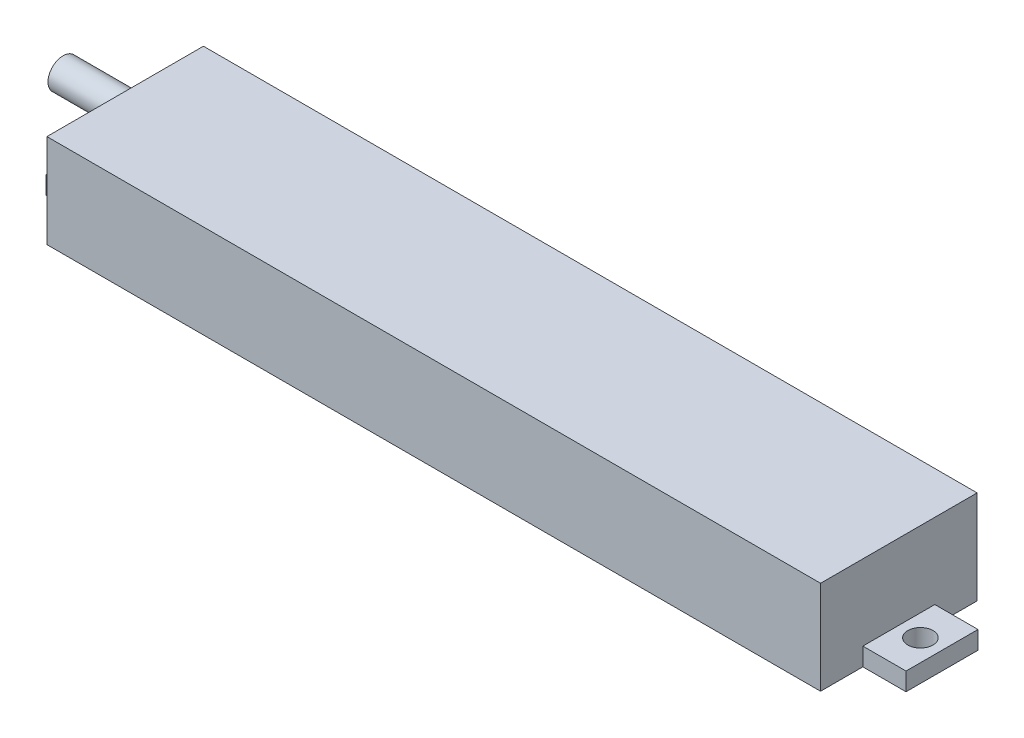
from build123d import *

# Parameters (mm, degrees)
SKETCH_1_W      = 215
SKETCH_1_H      = 43.5
EXTRUDE_1_DEPTH = 26
SKETCH_2_W      = 12
SKETCH_2_H      = 20
SKETCH_2_R      = 3.5
EXTRUDE_2_DEPTH = 5
SKETCH_3_R      = 4.2
EXTRUDE_3_DEPTH = 25


with BuildPart() as part:
    # ｽｹｯﾁ1 → ﾎﾞｽ - 押し出し1 (new body)
    with BuildSketch(Plane(origin=(0, 0, 0), x_dir=(1, 0, 0), z_dir=(0, 1, 0))):
        Rectangle(SKETCH_1_W, SKETCH_1_H)
    extrude(amount=EXTRUDE_1_DEPTH)

    # ｽｹｯﾁ2 → ﾎﾞｽ - 押し出し2 (add)
    # profile 1 of 2: a face of its own
    with BuildSketch(Plane.XZ):
        with Locations((-113.5, 0)):
            Rectangle(SKETCH_2_W, SKETCH_2_H)
        with Locations(Location((-113.5, 0, 0), (0, 0, 270))):
            Circle(SKETCH_2_R, mode=Mode.SUBTRACT)
    # profile 2 of 2: a face of its own
    with BuildSketch(Plane.XZ):
        with Locations((113.5, 0)):
            Rectangle(SKETCH_2_W, SKETCH_2_H)
        with Locations(Location((113.5, 0, 0), (0, 0, 90))):
            Circle(SKETCH_2_R, mode=Mode.SUBTRACT)
    extrude(amount=-EXTRUDE_2_DEPTH)

    # ｽｹｯﾁ3 → ﾎﾞｽ - 押し出し3 (add)
    with BuildSketch(Plane.ZY.offset(107.5)):
        with Locations(Location((-7.75, 14, 0), (0, 0, 180))):
            Circle(SKETCH_3_R)
    extrude(amount=EXTRUDE_3_DEPTH)


solid = part.part
